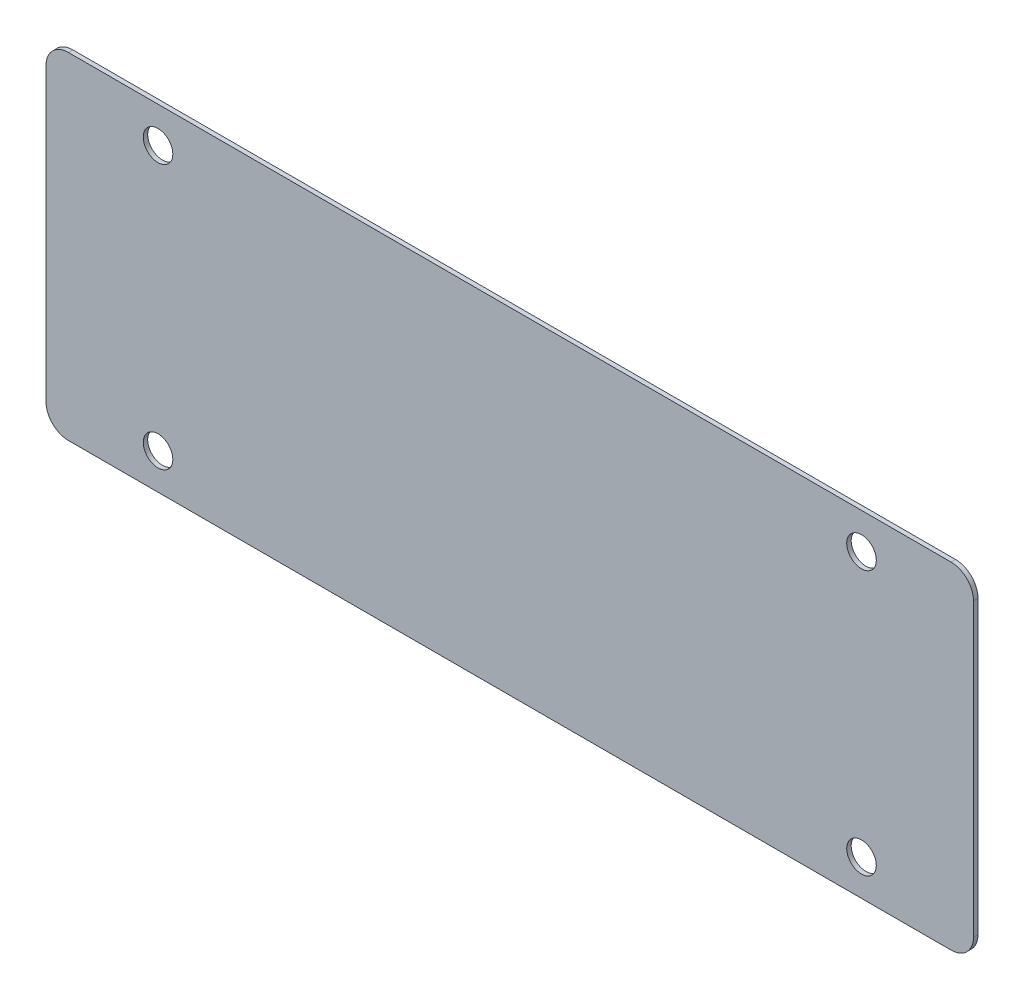
from build123d import *

# Parameters (mm, degrees)
SKETCH_1_W          = 207
SKETCH_1_H          = 75
EXTRUDE_1_DEPTH     = 1
SKETCH_2_R          = 3.3
CUT_EXTRUDE_1_DEPTH = 111.088600681
FILLET_1_R          = 5


with BuildPart() as part:
    # 草图1 → 凸台-拉伸1 (new body)
    with BuildSketch(Plane.XY):
        Rectangle(SKETCH_1_W, SKETCH_1_H)
    extrude(amount=EXTRUDE_1_DEPTH)

    # 草图2 → 切除-拉伸1 (cut, through all)
    with BuildSketch(Plane.XY.offset(1)):
        with Locations((-78.5, 29.5)):
            Circle(SKETCH_2_R)
        with Locations((78.5, 29.5)):
            Circle(SKETCH_2_R)
        with Locations((-78.5, -29.5)):
            Circle(SKETCH_2_R)
        with Locations((78.5, -29.5)):
            Circle(SKETCH_2_R)
    extrude(amount=-CUT_EXTRUDE_1_DEPTH, mode=Mode.SUBTRACT)

    # 圆角1
    fillet_1_edges = [part.edges().sort_by_distance(p)[0] for p in [
        (103.5, -37.5, 0.5),
        (-103.5, -37.5, 0.5),
        (-103.5, 37.5, 0.5),
        (103.5, 37.5, 0.5),
    ]]
    fillet(fillet_1_edges, radius=FILLET_1_R)


solid = part.part
